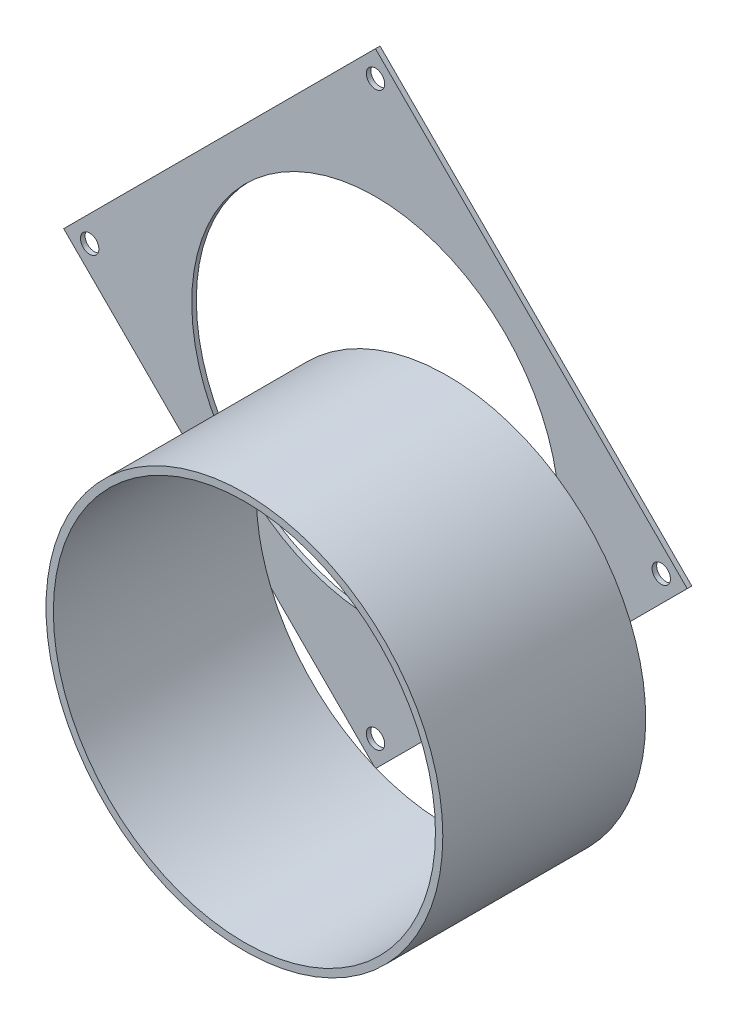
from build123d import *

# Parameters (mm, degrees)
BOSS_EXTRUDE1_START = -70.140187
SKETCH1_R           = 68.58
SKETCH1_R_2         = 66.04
BOSS_EXTRUDE1_DEPTH = 70.140187
SKETCH2_R           = 3.175
SKETCH2_R_2         = 63.5
BOSS_EXTRUDE2_DEPTH = 1.5875


with BuildPart() as part:
    # Sketch1 → Boss-Extrude1 (new body)
    with BuildSketch(Plane.XY.offset(BOSS_EXTRUDE1_START)):
        with Locations((24.840813797, -46.264409372)):
            Circle(SKETCH1_R)
        with Locations((24.840813797, -46.264409372)):
            Circle(SKETCH1_R_2, mode=Mode.SUBTRACT)
    extrude(amount=BOSS_EXTRUDE1_DEPTH)

    # Sketch2 → Boss-Extrude2 (add)
    with BuildSketch(Plane(origin=(0, 0, -70.14018706), x_dir=(-1, 0, 0), z_dir=(0, 0, -1))):
        Polygon((0, -107.763073453), (107.763073453, 0), (0, 107.763073453), (-107.763073453, 0), align=None)
        with Locations((0, 98.782817332)):
            Circle(SKETCH2_R, mode=Mode.SUBTRACT)
        with Locations((98.782817332, 0)):
            Circle(SKETCH2_R, mode=Mode.SUBTRACT)
        with Locations((0, -98.782817332)):
            Circle(SKETCH2_R, mode=Mode.SUBTRACT)
        with Locations((-98.782817332, 0)):
            Circle(SKETCH2_R, mode=Mode.SUBTRACT)
        with Locations(Location((0, 0, 0), (0, 0, 173.121854306))):
            Circle(SKETCH2_R_2, mode=Mode.SUBTRACT)
    extrude(amount=BOSS_EXTRUDE2_DEPTH)


solid = part.part
